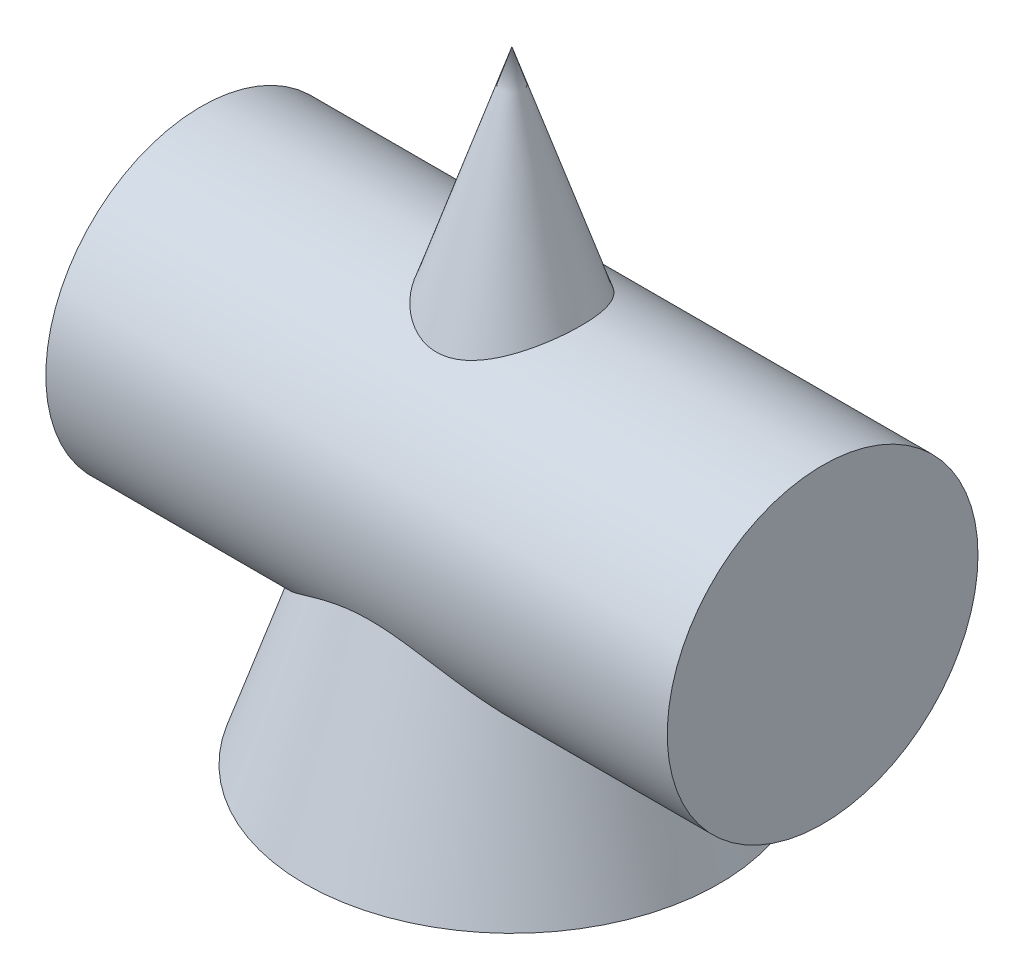
from build123d import *

# Parameters (mm, degrees)
SKETCH_1_R           = 20
EXTRUDE_2_DEPTH      = 30
EXTRUDE_2_DEPTH_BACK = 30
SKETCH_4_R           = 15


with BuildPart() as part:
    # 草图1 → 放样2 section 0
    with BuildSketch(Plane(origin=(0, 0, 0), x_dir=(1, 0, 0), z_dir=(0, 1, 0)), mode=Mode.PRIVATE) as loft_2_s0:
        Circle(SKETCH_1_R)
    loft([loft_2_s0.sketch, Vertex(0, 60, 0)])

    # 草图4 → 凸台-拉伸2 (add, two sides: drawn at the far end of the back side and taken through both)
    with BuildSketch(Plane(origin=(0, 0, 0), x_dir=(0, 0, -1), z_dir=(1, 0, 0)).offset(-EXTRUDE_2_DEPTH_BACK)):
        with Locations((0, 25)):
            Circle(SKETCH_4_R)
    extrude(amount=EXTRUDE_2_DEPTH + EXTRUDE_2_DEPTH_BACK)


solid = part.part
